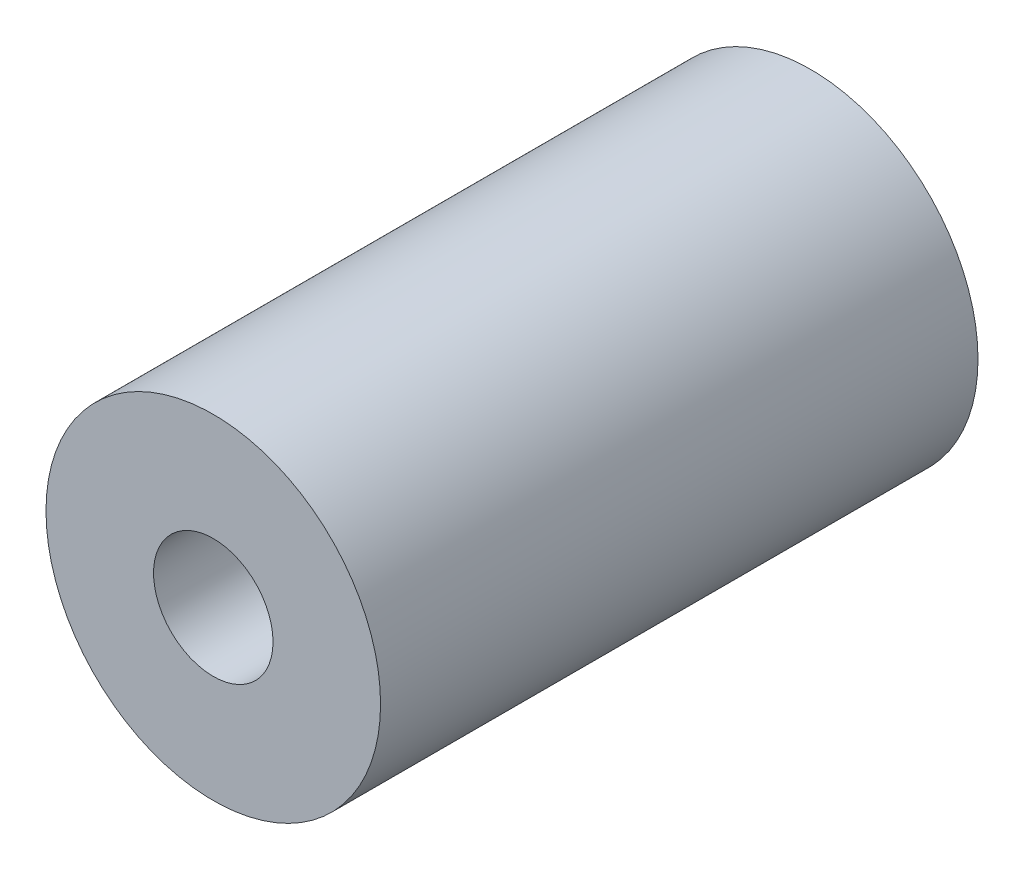
from build123d import *

# Parameters (mm, degrees)
SKETCH_1_R          = 7
EXTRUDE_1_DEPTH     = 25
SKETCH_2_R          = 2.5
CUT_EXTRUDE_1_DEPTH = 12.5
SKETCH_3_R          = 4
CUT_EXTRUDE_2_DEPTH = 15


with BuildPart() as part:
    # 草图1 → 凸台-拉伸1 (new body)
    with BuildSketch(Plane.XY):
        Circle(SKETCH_1_R)
    extrude(amount=EXTRUDE_1_DEPTH)

    # 草图2 → 切除-拉伸1 (cut)
    with BuildSketch(Plane.XY.offset(25)):
        Circle(SKETCH_2_R)
    extrude(amount=-CUT_EXTRUDE_1_DEPTH, mode=Mode.SUBTRACT)

    # 草图3 → 切除-拉伸2 (cut)
    with BuildSketch(Plane(origin=(0, 0, 0), x_dir=(-1, 0, 0), z_dir=(0, 0, -1))):
        Circle(SKETCH_3_R)
    extrude(amount=-CUT_EXTRUDE_2_DEPTH, mode=Mode.SUBTRACT)


solid = part.part
